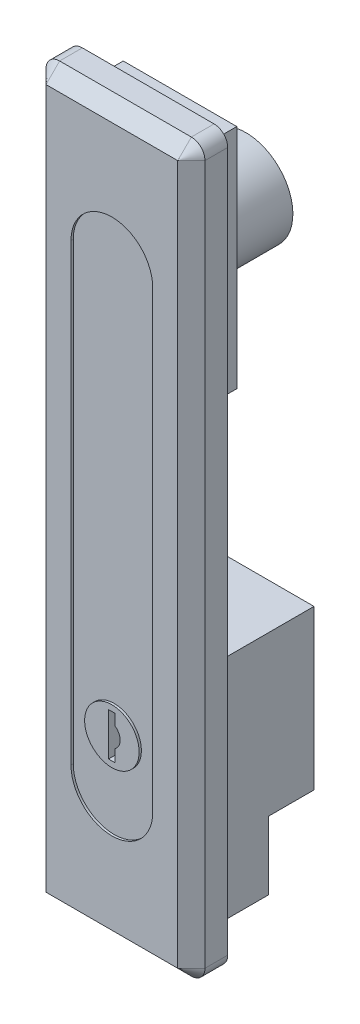
from build123d import *

# Parameters (mm, degrees)
SKETCH_1_W            = 35
SKETCH_1_H            = 160
EXTRUDE_1_DEPTH       = 8
FILLET_1_R            = 3
CHAMFER_1_SIZE        = 3
CUT_EXTRUDE_1_DEPTH   = 0.5
SKETCH_3_R            = 6
EXTRUDE_2_DEPTH       = 0.5
SKETCH_4_W            = 25
SKETCH_4_H            = 150
EXTRUDE_3_DEPTH       = 24
SKETCH_6_W            = 25
SKETCH_6_H            = 50
CUT_EXTRUDE_3_DEPTH   = 24
SKETCH_8_W            = 10
SKETCH_8_H            = 15
CUT_EXTRUDE_4_DEPTH   = 89.746830929
SKETCH_9_W            = 25
SKETCH_9_H            = 50
SKETCH_9_R            = 10.35
CUT_EXTRUDE_5_DEPTH   = 24
SKETCH_10_R           = 2
CUT_EXTRUDE_6_DEPTH   = 4
SKETCH_11_W           = 25
SKETCH_11_H           = 50
EXTRUDE_2_2_DEPTH     = 7
SKETCH_12_W           = 1.47707906
SKETCH_12_H           = 9.426983126
CUT_EXTRUDE_7_DEPTH   = 5
HOLE_WIZARD_M61_D     = 5
HOLE_WIZARD_M61_DEPTH = 17
HOLE_WIZARD_M61_TIP   = 1.502151548
SKETCH_16_R           = 2
CUT_EXTRUDE_8_DEPTH   = 7.5
SKETCH_17_R           = 10.35
SKETCH_17_W           = 8
SKETCH_17_H           = 8
CUT_EXTRUDE_9_DEPTH   = 2.5
CUT_EXTRUDE_10_DEPTH  = 3.5


with BuildPart() as part:
    # Эскиз1 → Вытянуть1 (new body)
    with BuildSketch(Plane.XY):
        Rectangle(SKETCH_1_W, SKETCH_1_H)
    extrude(amount=EXTRUDE_1_DEPTH)

    # Скругление1
    fillet_1_edges = [part.edges().sort_by_distance(p)[0] for p in [
        (-17.5, 80, 4),
        (17.5, 80, 4),
        (17.5, -80, 4),
        (-17.5, -80, 4),
    ]]
    fillet(fillet_1_edges, radius=FILLET_1_R)

    # Фаска1
    chamfer_1_edges = [part.edges().sort_by_distance(p)[0] for p in [
        (0, -80, 8),
        (-17.5, 0, 8),
        (17.5, 0, 8),
        (0, 80, 8),
        (16.621320344, 79.121320344, 8),
        (-16.621320344, 79.121320344, 8),
        (16.621320344, -79.121320344, 8),
        (-16.621320344, -79.121320344, 8),
    ]]
    chamfer(chamfer_1_edges, length=CHAMFER_1_SIZE)

    # Эскиз2 → Вырез-Вытянуть1 (cut)
    with BuildSketch(Plane.XY.offset(8)):
        with BuildLine():
            Line((-9, 50), (-9, -50))
            ThreePointArc((-9, -50), (0, -59), (9, -50))
            Line((9, -50), (9, 50))
            ThreePointArc((9, 50), (0, 59), (-9, 50))
        make_face()
    extrude(amount=-CUT_EXTRUDE_1_DEPTH, mode=Mode.SUBTRACT)

    # Эскиз3 → Extrude 2 (add)
    with BuildSketch(Plane.XY.offset(7.5)):
        with Locations((0, -40)):
            Circle(SKETCH_3_R)
    extrude(amount=EXTRUDE_2_DEPTH)

    # Эскиз4 → Вытянуть3 (add)
    with BuildSketch(Plane(origin=(0, 0, 0), x_dir=(-1, 0, 0), z_dir=(0, 0, -1))):
        Rectangle(SKETCH_4_W, SKETCH_4_H)
    extrude(amount=EXTRUDE_3_DEPTH)

    # Эскиз6 → Вырез-Вытянуть3 (cut)
    with BuildSketch(Plane(origin=(0, 0, -24), x_dir=(-1, 0, 0), z_dir=(0, 0, -1))):
        Rectangle(SKETCH_6_W, SKETCH_6_H)
    extrude(amount=-CUT_EXTRUDE_3_DEPTH, mode=Mode.SUBTRACT)

    # Эскиз8 → Вырез-Вытянуть4 (cut, through all)
    with BuildSketch(Plane(origin=(12.5, 0, 0), x_dir=(0, 0, -1), z_dir=(1, 0, 0))):
        with Locations((19, -67.5)):
            Rectangle(SKETCH_8_W, SKETCH_8_H)
    extrude(amount=-CUT_EXTRUDE_4_DEPTH, mode=Mode.SUBTRACT)

    # Эскиз9 → Вырез-Вытянуть5 (cut)
    with BuildSketch(Plane(origin=(0, 0, -24), x_dir=(-1, 0, 0), z_dir=(0, 0, -1))):
        with Locations((0, 50)):
            Rectangle(SKETCH_9_W, SKETCH_9_H)
        with Locations((0, 50)):
            Circle(SKETCH_9_R, mode=Mode.SUBTRACT)
    extrude(amount=-CUT_EXTRUDE_5_DEPTH, mode=Mode.SUBTRACT)

    # Эскиз10 → Вырез-Вытянуть6 (cut)
    with BuildSketch(Plane(origin=(0, 0, -14), x_dir=(-1, 0, 0), z_dir=(0, 0, -1))):
        with Locations((0, -69)):
            Circle(SKETCH_10_R)
    extrude(amount=-CUT_EXTRUDE_6_DEPTH, mode=Mode.SUBTRACT)

    # Эскиз11 → Extrude 2 2 (add)
    with BuildSketch(Plane(origin=(0, 0, 0), x_dir=(-1, 0, 0), z_dir=(0, 0, -1))):
        with Locations((0, 50)):
            Rectangle(SKETCH_11_W, SKETCH_11_H)
    extrude(amount=EXTRUDE_2_2_DEPTH)

    # Эскиз12 → Вырез-Вытянуть7 (cut)
    with BuildSketch(Plane.XY.offset(8)):
        with Locations((0, -40)):
            Rectangle(SKETCH_12_W, SKETCH_12_H)
        with BuildLine():
            ThreePointArc((0.73853953, -42.00191483), (1.817071347, -39.86854196), (0.73853953, -37.73516909))
            Line((0.73853953, -37.73516909), (0.73853953, -42.00191483))
        make_face()
    extrude(amount=-CUT_EXTRUDE_7_DEPTH, mode=Mode.SUBTRACT)

    # Отверстие обработанное метчиком M61
    with Locations(Plane(origin=(0, 0, -24), x_dir=(-1, 0, 0), z_dir=(0, 0, -1))):
        with Locations((0, 50)):
            Hole(HOLE_WIZARD_M61_D / 2, depth=HOLE_WIZARD_M61_DEPTH)
            with Locations((0, 0, -(HOLE_WIZARD_M61_DEPTH + HOLE_WIZARD_M61_TIP / 2))):  # 118° drill point
                Cone(0, HOLE_WIZARD_M61_D / 2, HOLE_WIZARD_M61_TIP, mode=Mode.SUBTRACT)

    # Эскиз16 → Вырез-Вытянуть8 (cut)
    with BuildSketch(Plane(origin=(0, 0, -7), x_dir=(-1, 0, 0), z_dir=(0, 0, -1))):
        with Locations((0, 31)):
            Circle(SKETCH_16_R)
        with Locations(Location((0, 69, 0), (0, 0, 180))):
            Circle(SKETCH_16_R)
    extrude(amount=-CUT_EXTRUDE_8_DEPTH, mode=Mode.SUBTRACT)

    # Эскиз17 → Вырез-Вытянуть9 (cut)
    with BuildSketch(Plane(origin=(0, 0, -24), x_dir=(-1, 0, 0), z_dir=(0, 0, -1))):
        with Locations((0, 50)):
            Circle(SKETCH_17_R)
        with Locations((0, 50)):
            Rectangle(SKETCH_17_W, SKETCH_17_H, mode=Mode.SUBTRACT)
    extrude(amount=-CUT_EXTRUDE_9_DEPTH, mode=Mode.SUBTRACT)

    # Эскиз18 → Вырез-Вытянуть10 (cut)
    with BuildSketch(Plane(origin=(0, 0, -21.5), x_dir=(-1, 0, 0), z_dir=(0, 0, -1))):
        with BuildLine():
            Line((0, 44.343145751), (0, 39.65))
            ThreePointArc((0, 39.65), (7.318555185, 42.681444815), (10.35, 50))
            Line((10.35, 50), (5.656854249, 50))
            ThreePointArc((5.656854249, 50), (4, 46), (0, 44.343145751))
        make_face()
    extrude(amount=-CUT_EXTRUDE_10_DEPTH, mode=Mode.SUBTRACT)


solid = part.part
